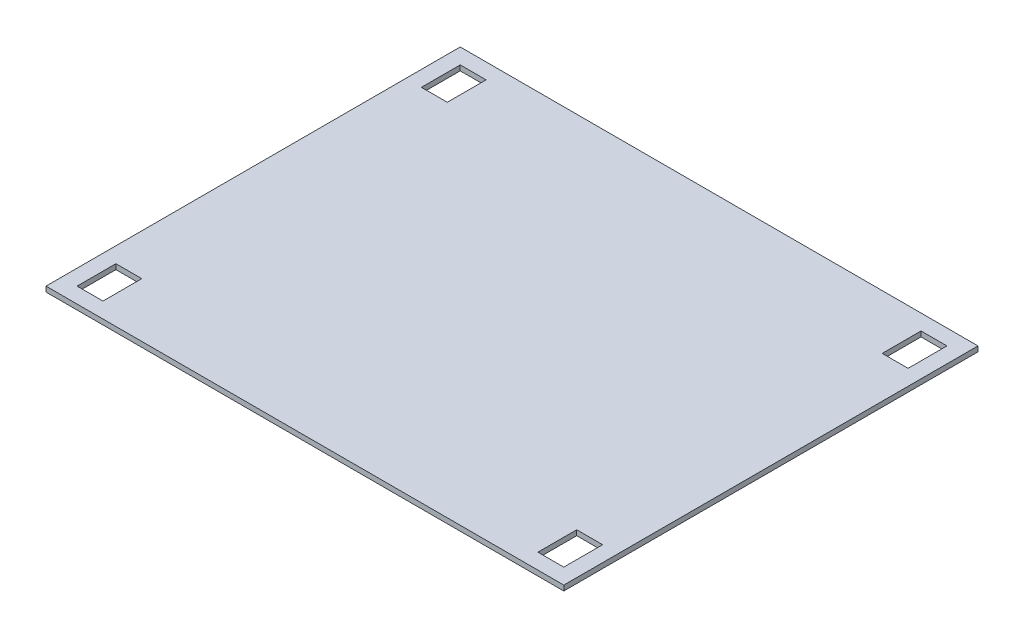
from build123d import *

# Parameters (mm, degrees)
SKETCH1_W           = 127
SKETCH1_H           = 101.6
BOSS_EXTRUDE1_DEPTH = 1.27
CUT_EXTRUDE1_REACH  = 83.33
SKETCH2_W           = 6.35
SKETCH2_H           = 9.525


with BuildPart() as part:
    # Sketch1 → Boss-Extrude1 (new body)
    with BuildSketch(Plane(origin=(0, 0, 0), x_dir=(1, 0, 0), z_dir=(0, 1, 0))):
        Rectangle(SKETCH1_W, SKETCH1_H)
    extrude(amount=BOSS_EXTRUDE1_DEPTH)

    # Sketch2 → Cut-Extrude1 (cut, up to next)
    with BuildSketch(Plane(origin=(0, 1.27, 0), x_dir=(1, 0, 0), z_dir=(0, 1, 0)), mode=Mode.PRIVATE) as cut_extrude1_sk1:
        with Locations((-56.515, 42.2275)):
            Rectangle(SKETCH2_W, SKETCH2_H)
    cut_extrude1_tool1 = extrude(cut_extrude1_sk1.sketch, amount=-CUT_EXTRUDE1_REACH, mode=Mode.PRIVATE) & part.part
    # Sketch2 → Cut-Extrude1 (cut, up to next)
    with BuildSketch(Plane(origin=(0, 1.27, 0), x_dir=(1, 0, 0), z_dir=(0, 1, 0)), mode=Mode.PRIVATE) as cut_extrude1_sk2:
        with Locations((56.515, 42.2275)):
            Rectangle(SKETCH2_W, SKETCH2_H)
    cut_extrude1_tool2 = extrude(cut_extrude1_sk2.sketch, amount=-CUT_EXTRUDE1_REACH, mode=Mode.PRIVATE) & part.part
    # Sketch2 → Cut-Extrude1 (cut, up to next)
    with BuildSketch(Plane(origin=(0, 1.27, 0), x_dir=(1, 0, 0), z_dir=(0, 1, 0)), mode=Mode.PRIVATE) as cut_extrude1_sk3:
        with Locations((56.515, -42.2275)):
            Rectangle(SKETCH2_W, SKETCH2_H)
    cut_extrude1_tool3 = extrude(cut_extrude1_sk3.sketch, amount=-CUT_EXTRUDE1_REACH, mode=Mode.PRIVATE) & part.part
    # Sketch2 → Cut-Extrude1 (cut, up to next)
    with BuildSketch(Plane(origin=(0, 1.27, 0), x_dir=(1, 0, 0), z_dir=(0, 1, 0)), mode=Mode.PRIVATE) as cut_extrude1_sk4:
        with Locations((-56.515, -42.2275)):
            Rectangle(SKETCH2_W, SKETCH2_H)
    cut_extrude1_tool4 = extrude(cut_extrude1_sk4.sketch, amount=-CUT_EXTRUDE1_REACH, mode=Mode.PRIVATE) & part.part
    add(cut_extrude1_tool1.solids().sort_by_distance((-56.515, 1.27, -42.2275))[0], mode=Mode.SUBTRACT)
    add(cut_extrude1_tool2.solids().sort_by_distance((56.515, 1.27, -42.2275))[0], mode=Mode.SUBTRACT)
    add(cut_extrude1_tool3.solids().sort_by_distance((56.515, 1.27, 42.2275))[0], mode=Mode.SUBTRACT)
    add(cut_extrude1_tool4.solids().sort_by_distance((-56.515, 1.27, 42.2275))[0], mode=Mode.SUBTRACT)


solid = part.part
